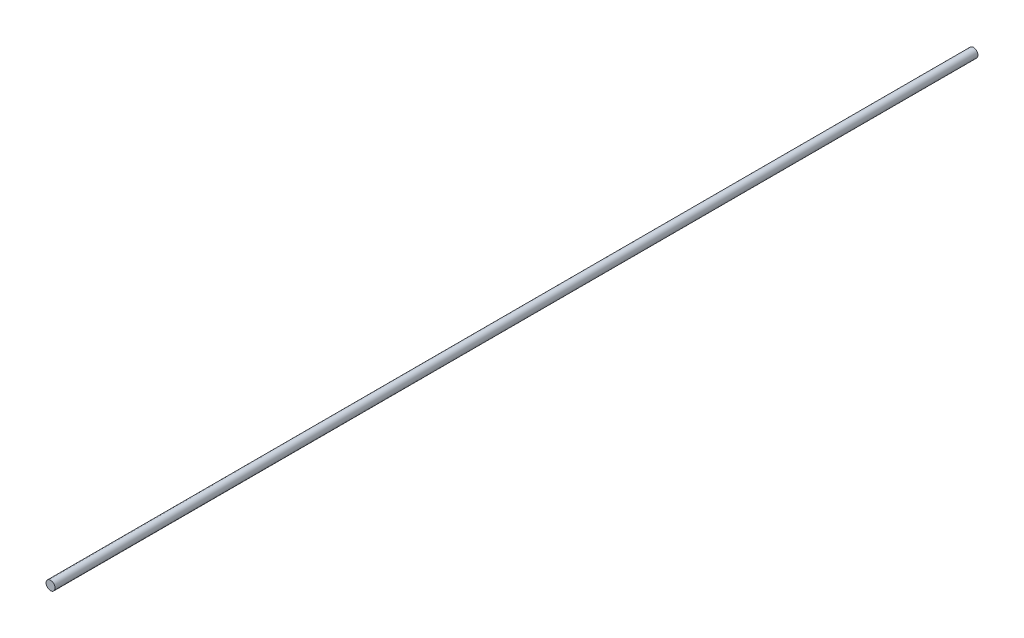
from build123d import *

# Parameters (mm, degrees)
SKETCH1_R           = 1
BOSS_EXTRUDE1_DEPTH = 205


with BuildPart() as part:
    # Sketch1 → Boss-Extrude1 (new body)
    with BuildSketch(Plane.XY):
        with Locations(Location((0, 0, 0), (0, 0, 180))):
            Circle(SKETCH1_R)
    extrude(amount=BOSS_EXTRUDE1_DEPTH)


solid = part.part
